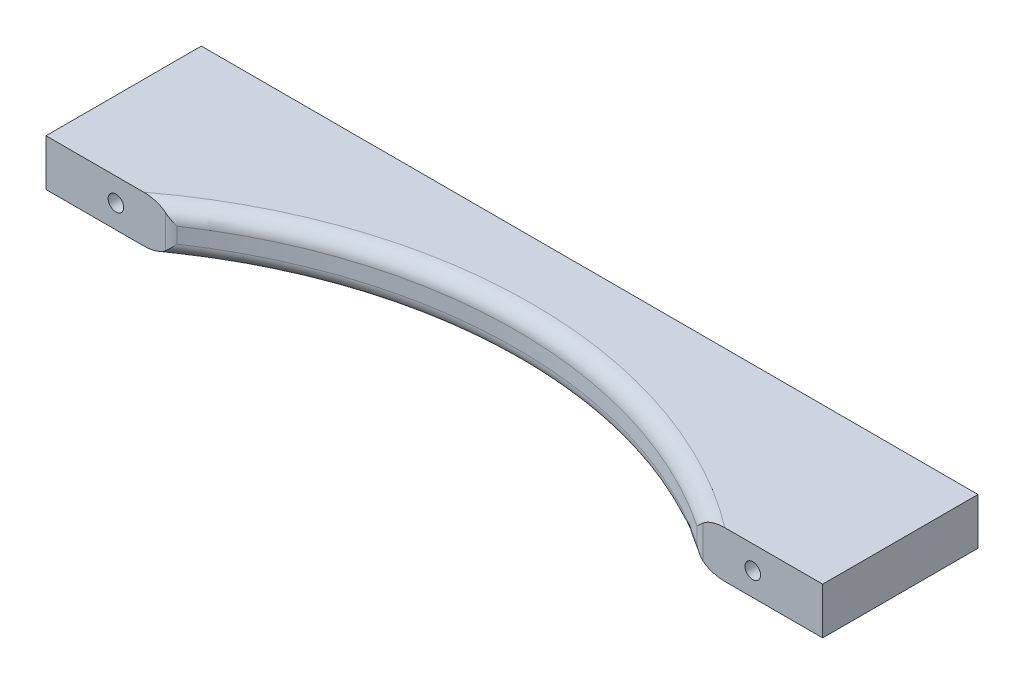
from build123d import *

# Parameters (mm, degrees)
SKETCH1_R           = 2.5
BOSS_EXTRUDE1_DEPTH = 50
CUT_EXTRUDE1_DEPTH  = 15
FILLET1_R           = 5


with BuildPart() as part:
    # Sketch1 → Boss-Extrude1 (new body)
    with BuildSketch(Plane.XY):
        Polygon((80, -46.25), (102.5, -46.25), (102.5, -31.25), (80, -31.25), (-147.5, -31.25), (-147.5, -46.25), align=None)
        with Locations((-125, -38.75)):
            Circle(SKETCH1_R, mode=Mode.SUBTRACT)
        with Locations((80, -38.75)):
            Circle(SKETCH1_R, mode=Mode.SUBTRACT)
    extrude(amount=BOSS_EXTRUDE1_DEPTH)

    # Sketch2 → Cut-Extrude1 (cut)
    with BuildSketch(Plane.XZ.offset(46.25)):
        with BuildLine():
            Line((-107.5, 50), (62.5, 50))
            ThreePointArc((62.5, 50), (-22.5, 23.592070943), (-107.5, 50))
        make_face()
    extrude(amount=-CUT_EXTRUDE1_DEPTH, mode=Mode.SUBTRACT)

    # Fillet1
    fillet1_edges = [part.edges().sort_by_distance(p)[0] for p in [
        (62.5, -38.75, 50),
        (-107.5, -38.75, 50),
        (-22.5, -46.25, 23.592070943),
        (-22.5, -31.25, 23.592070943),
    ]]
    fillet(fillet1_edges, radius=FILLET1_R)


solid = part.part
